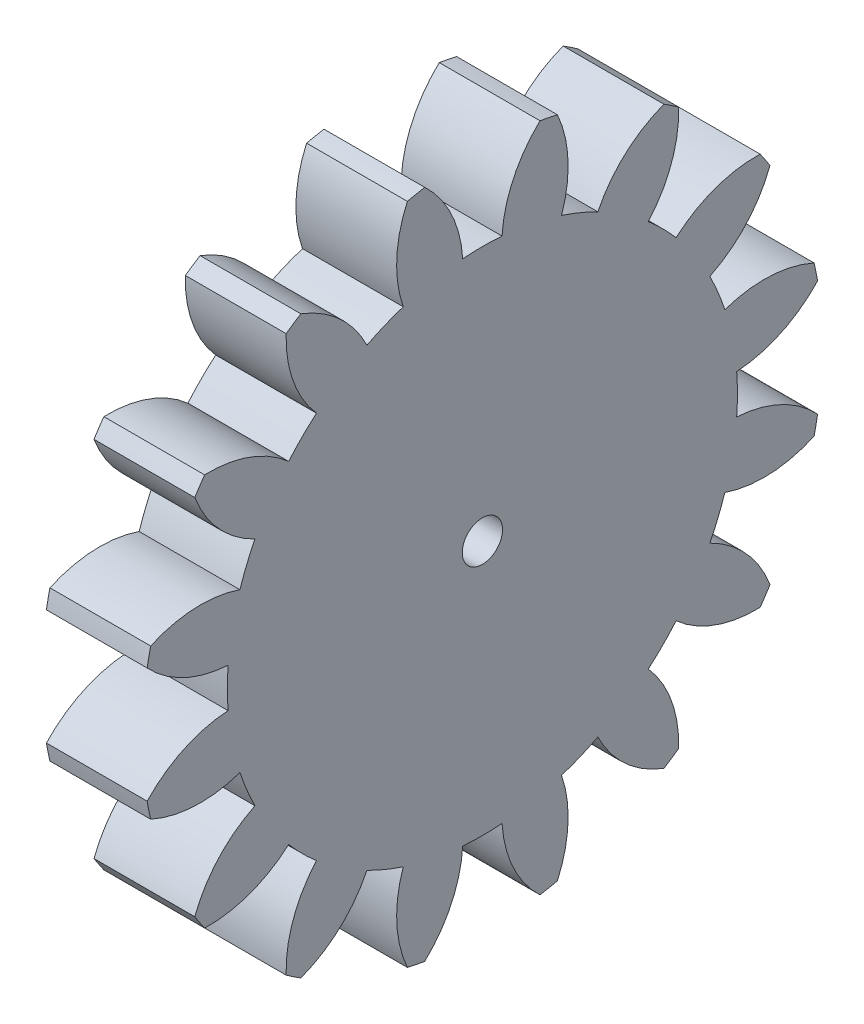
from build123d import *

# Parameters (mm, degrees)
BASPROSKE_W         = 8
BASPROSKE_H         = 27
TOOTHCUT_DEPTH      = 40.012818406
TEETHCUTS_COUNT     = 16
TEETHCUTS_ANGLE     = 337.5
BORSKE_R            = 0.4
BORE_DEPTH          = 50.0000508
SKETCH_1_R          = 1.6
CUT_EXTRUDE_1_DEPTH = 10


with BuildPart() as part:
    # BasProSke → Base-Revolve (revolve)
    with BuildSketch(Plane(origin=(0, 0, 0), x_dir=(1, 0, 0), z_dir=(0, 1, 0))):
        with Locations((4, 13.5)):
            Rectangle(BASPROSKE_W, BASPROSKE_H)
    revolve(axis=Axis((-10, 0, 0), (1, 0, 0)))

    # TooCutSke → ToothCut (cut, through all)
    with BuildSketch(Plane(origin=(0, 0, 0), x_dir=(0, 0, -1), z_dir=(1, 0, 0))):
        with BuildLine():
            ThreePointArc((1.561154384, 20.188729479), (0, 20.249), (-1.561154384, 20.188729479))
            ThreePointArc((-1.561154384, 20.188729479), (-2.460699582, 23.702149247), (-4.599478859, 26.631129142))
            ThreePointArc((-4.599478859, 26.631129142), (0, 27.0254), (4.599478859, 26.631129142))
            ThreePointArc((4.599478859, 26.631129142), (2.460699582, 23.702149247), (1.561154384, 20.188729479))
        make_face()
    toothcut = extrude(amount=TOOTHCUT_DEPTH, mode=Mode.SUBTRACT)

    # TeethCuts: ToothCut ×16 about axis
    teethcuts_axis = Axis((-10, 0, 0), (1, 0, 0))
    for i in range(1, TEETHCUTS_COUNT):
        add(toothcut.rotate(teethcuts_axis, i * TEETHCUTS_ANGLE / (TEETHCUTS_COUNT - 1)), mode=Mode.SUBTRACT)

    # BorSke → Bore (cut, symmetric)
    with BuildSketch(Plane(origin=(0, 0, 0), x_dir=(0, 0, -1), z_dir=(1, 0, 0))):
        Circle(BORSKE_R)
    extrude(amount=BORE_DEPTH, both=True, mode=Mode.SUBTRACT)

    # 草图1 → 切除-拉伸1 (cut)
    with BuildSketch(Plane(origin=(8, 0, 0), x_dir=(0, 0, -1), z_dir=(1, 0, 0))):
        Circle(SKETCH_1_R)
    extrude(amount=-CUT_EXTRUDE_1_DEPTH, mode=Mode.SUBTRACT)


solid = part.part
